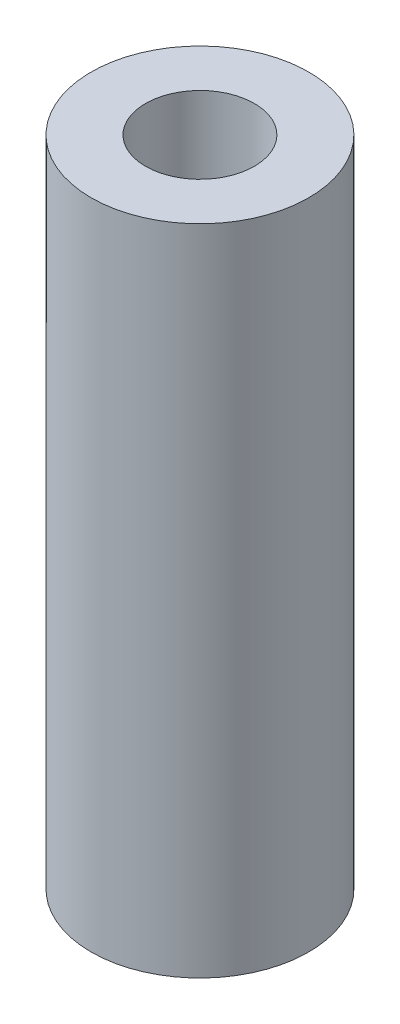
from build123d import *

# Parameters (mm, degrees)
SKETCH1_R           = 5
SKETCH1_R_2         = 2.5
BOSS_EXTRUDE1_DEPTH = 30


with BuildPart() as part:
    # Sketch1 → Boss-Extrude1 (new body)
    with BuildSketch(Plane(origin=(0, 0, 0), x_dir=(1, 0, 0), z_dir=(0, 1, 0))):
        with Locations(Location((0, 0, 0), (0, 0, 270))):
            Circle(SKETCH1_R)
        with Locations(Location((0, 0, 0), (0, 0, 270))):
            Circle(SKETCH1_R_2, mode=Mode.SUBTRACT)
    extrude(amount=BOSS_EXTRUDE1_DEPTH)


solid = part.part
